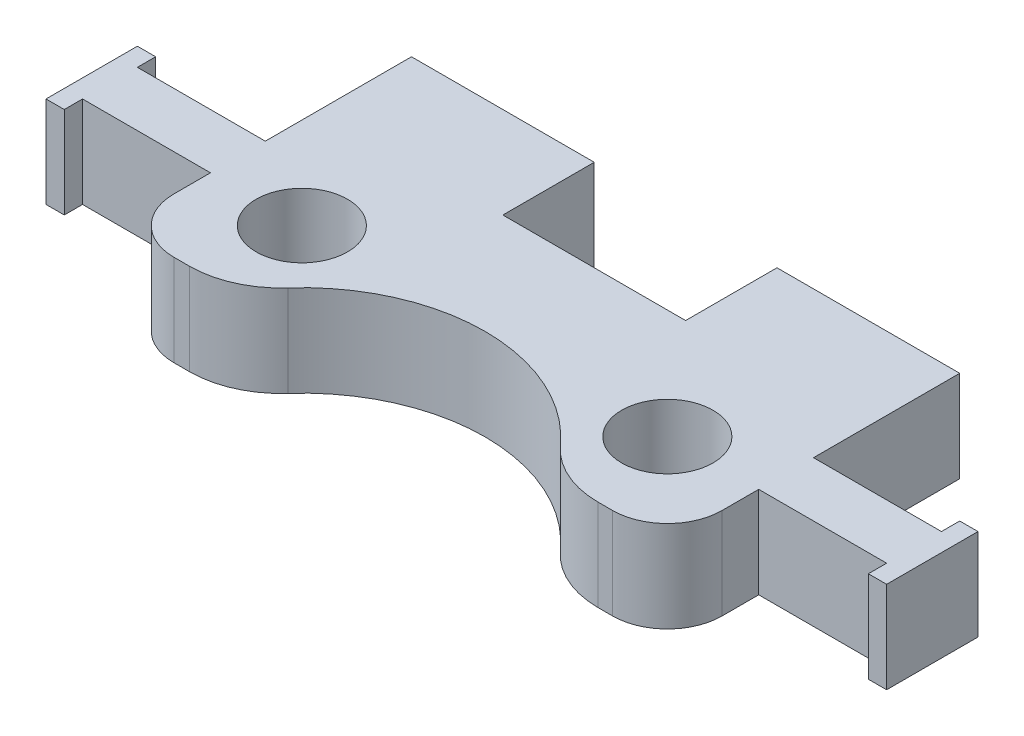
from build123d import *

# Parameters (mm, degrees)
SKETCH_1_R      = 2.5
EXTRUDE_1_DEPTH = 5


with BuildPart() as part:
    # 草图1 → 凸台-拉伸1 (new body)
    with BuildSketch(Plane(origin=(0, 0, 0), x_dir=(1, 0, 0), z_dir=(0, 1, 0))):
        with BuildLine():
            Line((20, 21), (30, 21))
            Line((30, 21), (30, 13))
            Line((30, 13), (37, 13))
            Line((37, 13), (37, 14))
            Line((37, 14), (38, 14))
            Line((38, 14), (38, 9))
            Line((38, 9), (37, 9))
            Line((37, 9), (37, 10))
            Line((37, 10), (30, 10))
            Line((30, 10), (30, 8))
            ThreePointArc((30, 8), (29.121320344, 5.878679656), (27, 5))
            Line((27, 5), (26.206359593, 5))
            ThreePointArc((26.206359593, 5), (24.165118141, 5.435645354), (22.47957963, 6.666666667))
            ThreePointArc((22.47957963, 6.666666667), (15.026019705, 10), (7.57245978, 6.666666667))
            ThreePointArc((7.57245978, 6.666666667), (5.88692127, 5.435645354), (3.845679818, 5))
            Line((3.845679818, 5), (3, 5))
            ThreePointArc((3, 5), (0.878679656, 5.878679656), (0, 8))
            Line((0, 8), (0, 10))
            Line((0, 10), (-7, 10))
            Line((-7, 10), (-7, 9))
            Line((-7, 9), (-8, 9))
            Line((-8, 9), (-8, 14))
            Line((-8, 14), (-7, 14))
            Line((-7, 14), (-7, 13))
            Line((-7, 13), (0, 13))
            Line((0, 13), (0, 21))
            Line((0, 21), (10, 21))
            Line((10, 21), (10, 16))
            Line((10, 16), (20, 16))
            Line((20, 16), (20, 21))
        make_face()
        with Locations(Location((5, 10, 0), (0, 0, 270))):
            Circle(SKETCH_1_R, mode=Mode.SUBTRACT)
        with Locations(Location((25, 10, 0), (0, 0, 270))):
            Circle(SKETCH_1_R, mode=Mode.SUBTRACT)
    extrude(amount=EXTRUDE_1_DEPTH)


solid = part.part
